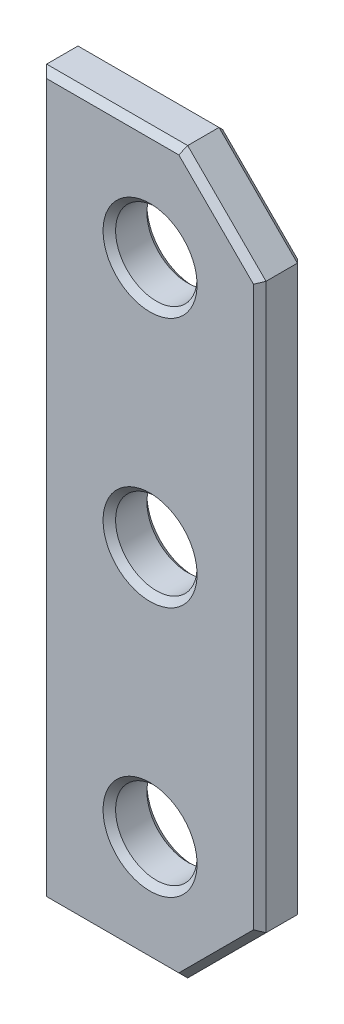
from build123d import *

# Parameters (mm, degrees)
SKETCH_1_R        = 13
EXTRUDE_477_DEPTH = 14
CHAMFER_1_SIZE    = 2


with BuildPart() as part:
    # 草图1 → Extrude 477 (new body)
    with BuildSketch(Plane.XY):
        Polygon((0, 0), (45, 0), (70, 25), (70, 205), (45, 230), (0, 230), align=None)
        with Locations((35, 35)):
            Circle(SKETCH_1_R, mode=Mode.SUBTRACT)
        with Locations((35, 115)):
            Circle(SKETCH_1_R, mode=Mode.SUBTRACT)
        with Locations((35, 195)):
            Circle(SKETCH_1_R, mode=Mode.SUBTRACT)
    extrude(amount=EXTRUDE_477_DEPTH)

    # 倒角1
    chamfer_1_edges = [part.edges().sort_by_distance(p)[0] for p in [
        (57.5, 12.5, 14),
        (70, 115, 14),
        (57.5, 217.5, 14),
        (22, 35, 0),
        (22, 35, 14),
        (22.5, 230, 14),
        (22, 115, 0),
        (22, 115, 14),
        (22, 195, 0),
        (22, 195, 14),
        (0, 115, 14),
        (22.5, 230, 0),
        (57.5, 217.5, 0),
        (70, 115, 0),
        (22.5, 0, 14),
        (57.5, 12.5, 0),
        (22.5, 0, 0),
        (0, 115, 0),
    ]]
    chamfer(chamfer_1_edges, length=CHAMFER_1_SIZE)


solid = part.part
